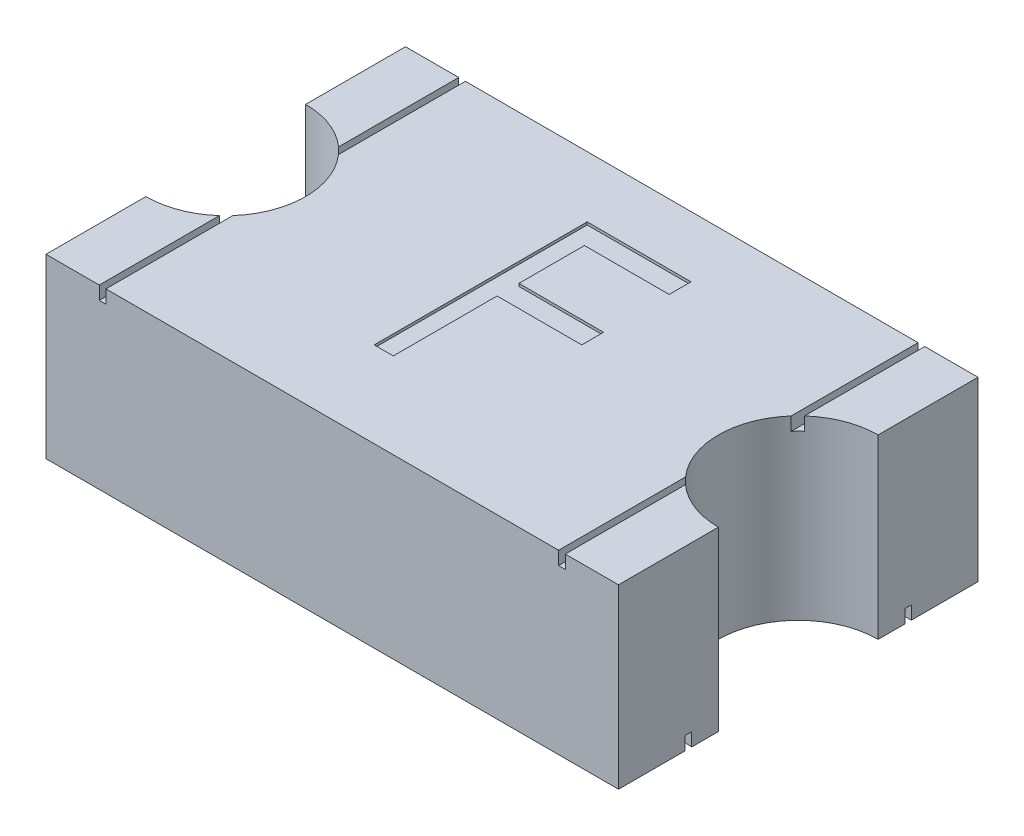
from build123d import *

# Parameters (mm, degrees)
SKETCH1_W                  = 2.15
SKETCH1_H                  = 1.35
BOSS_EXTRUDE1_DEPTH        = 0.665
SKETCH2_W                  = 0.025
SKETCH2_H                  = 0.05
CUT_EXTRUDE1_DEPTH         = 2.849418828
SKETCH3_W                  = 0.025
SKETCH3_H                  = 0.05
CUT_EXTRUDE2_DEPTH         = 2.849418828
CUT_EXTRUDE3_DEPTH         = 0.05
BOSS_EXTRUDE2_DEPTH        = 0.05
CUT_EXTRUDE4_DEPTH         = 0.05
BOSS_EXTRUDE3_DEPTH        = 0.05
F_0_6_0_6_DIAMETER_HOLE1_D = 0.6
CUT_EXTRUDE5_DEPTH         = 0.01


with BuildPart() as part:
    # Sketch1 → Boss-Extrude1 (new body)
    with BuildSketch(Plane(origin=(0, 0.665, 0), x_dir=(1, 0, 0), z_dir=(0, 1, 0))):
        Rectangle(SKETCH1_W, SKETCH1_H)
    extrude(amount=-BOSS_EXTRUDE1_DEPTH)

    # Sketch2 → Cut-Extrude1 (cut, through all)
    with BuildSketch(Plane.XY.offset(0.675)):
        with Locations((0.8625, 0.64)):
            Rectangle(SKETCH2_W, SKETCH2_H)
    extrude(amount=-CUT_EXTRUDE1_DEPTH, mode=Mode.SUBTRACT)

    # Sketch3 → Cut-Extrude2 (cut, through all)
    with BuildSketch(Plane.XY.offset(0.675)):
        with Locations((-0.8625, 0.64)):
            Rectangle(SKETCH3_W, SKETCH3_H)
    extrude(amount=-CUT_EXTRUDE2_DEPTH, mode=Mode.SUBTRACT)

    # Sketch4 → Cut-Extrude3 (cut)
    with BuildSketch(Plane.XZ):
        with BuildLine():
            Line((-1.075, 0.425), (-1.075, -0.425))
            ThreePointArc((-1.075, -0.425), (-0.65, 0), (-1.075, 0.425))
        make_face()
    extrude(amount=-CUT_EXTRUDE3_DEPTH, mode=Mode.SUBTRACT)

    # Sketch5 → Boss-Extrude2 (add)
    with BuildSketch(Plane.XZ.offset(-0.05)):
        with BuildLine():
            Line((-1.075, -0.4), (-1.075, 0.4))
            ThreePointArc((-1.075, 0.4), (-0.675, 0), (-1.075, -0.4))
        make_face()
    extrude(amount=BOSS_EXTRUDE2_DEPTH)

    # Sketch6 → Cut-Extrude4 (cut)
    with BuildSketch(Plane.XZ):
        with BuildLine():
            Line((1.075, -0.425), (1.075, 0.425))
            ThreePointArc((1.075, 0.425), (0.65, 0), (1.075, -0.425))
        make_face()
    extrude(amount=-CUT_EXTRUDE4_DEPTH, mode=Mode.SUBTRACT)

    # Sketch7 → Boss-Extrude3 (add)
    with BuildSketch(Plane.XZ.offset(-0.05)):
        with BuildLine():
            Line((1.075, 0.4), (1.075, -0.4))
            ThreePointArc((1.075, -0.4), (0.675, 0), (1.075, 0.4))
        make_face()
    extrude(amount=BOSS_EXTRUDE3_DEPTH)

    # Ø0.6 (0.6) Diameter Hole1 (through all)
    with Locations(Plane(origin=(0, 0, 0), x_dir=(-1, 0, 0), z_dir=(0, -1, 0))):
        with Locations((1.075, 0), (-1.075, 0)):
            Hole(F_0_6_0_6_DIAMETER_HOLE1_D / 2)

    # Sketch10 → Cut-Extrude5 (cut)
    with BuildSketch(Plane(origin=(0, 0.665, 0), x_dir=(1, 0, 0), z_dir=(0, 1, 0))):
        Polygon((-0.164102564, 0.446504379), (0.225641026, 0.446504379), (0.225641026, 0.364453097), (-0.092307692, 0.364453097), (-0.092307692, 0.118299251), (0.225641026, 0.118299251), (0.225641026, 0.036247969), (-0.092307692, 0.036247969), (-0.092307692, -0.353495621), (-0.164102564, -0.353495621), align=None)
    extrude(amount=-CUT_EXTRUDE5_DEPTH, mode=Mode.SUBTRACT)


solid = part.part
